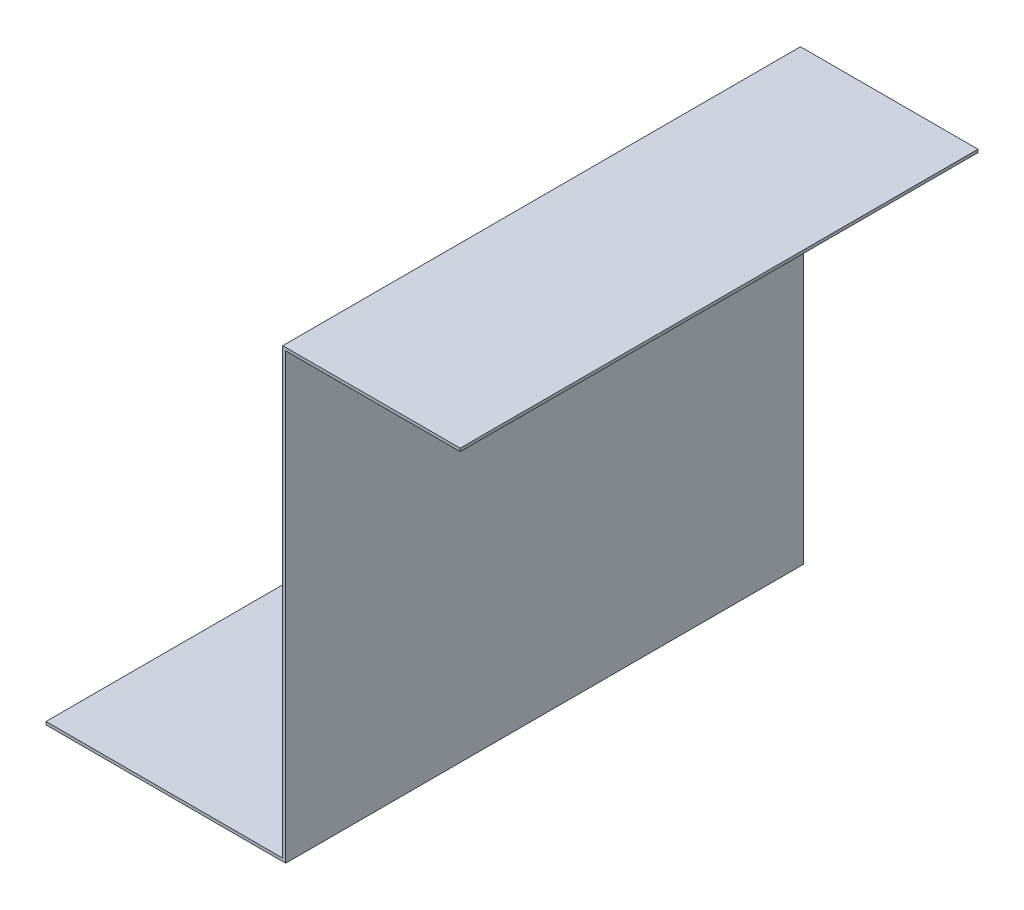
from build123d import *

# Parameters (mm, degrees)
SKETCH1_W           = 80
SKETCH1_H           = 175
SKETCH1_R           = 2.5
BOSS_EXTRUDE1_DEPTH = 1
SKETCH2_W           = 175
SKETCH2_H           = 150
BOSS_EXTRUDE2_DEPTH = 1
SKETCH3_W           = 60
SKETCH3_H           = 175
BOSS_EXTRUDE3_DEPTH = 1


with BuildPart() as part:
    # Sketch1 → Boss-Extrude1 (new body)
    with BuildSketch(Plane(origin=(0, 0, 0), x_dir=(1, 0, 0), z_dir=(0, 1, 0))):
        Rectangle(SKETCH1_W, SKETCH1_H)
        with Locations(Location((-4, 19.6, 0), (0, 0, 270))):
            Circle(SKETCH1_R, mode=Mode.SUBTRACT)
        with Locations(Location((-4, -19.6, 0), (0, 0, 90))):
            Circle(SKETCH1_R, mode=Mode.SUBTRACT)
    extrude(amount=BOSS_EXTRUDE1_DEPTH)

    # Sketch2 → Boss-Extrude2 (add)
    with BuildSketch(Plane(origin=(40, 0, 0), x_dir=(0, 0, -1), z_dir=(1, 0, 0))):
        with Locations((0, 75)):
            Rectangle(SKETCH2_W, SKETCH2_H)
    extrude(amount=BOSS_EXTRUDE2_DEPTH)

    # Sketch3 → Boss-Extrude3 (add)
    with BuildSketch(Plane(origin=(0, 150, 0), x_dir=(1, 0, 0), z_dir=(0, 1, 0))):
        with Locations((70, 0)):
            Rectangle(SKETCH3_W, SKETCH3_H)
    extrude(amount=BOSS_EXTRUDE3_DEPTH)


solid = part.part
